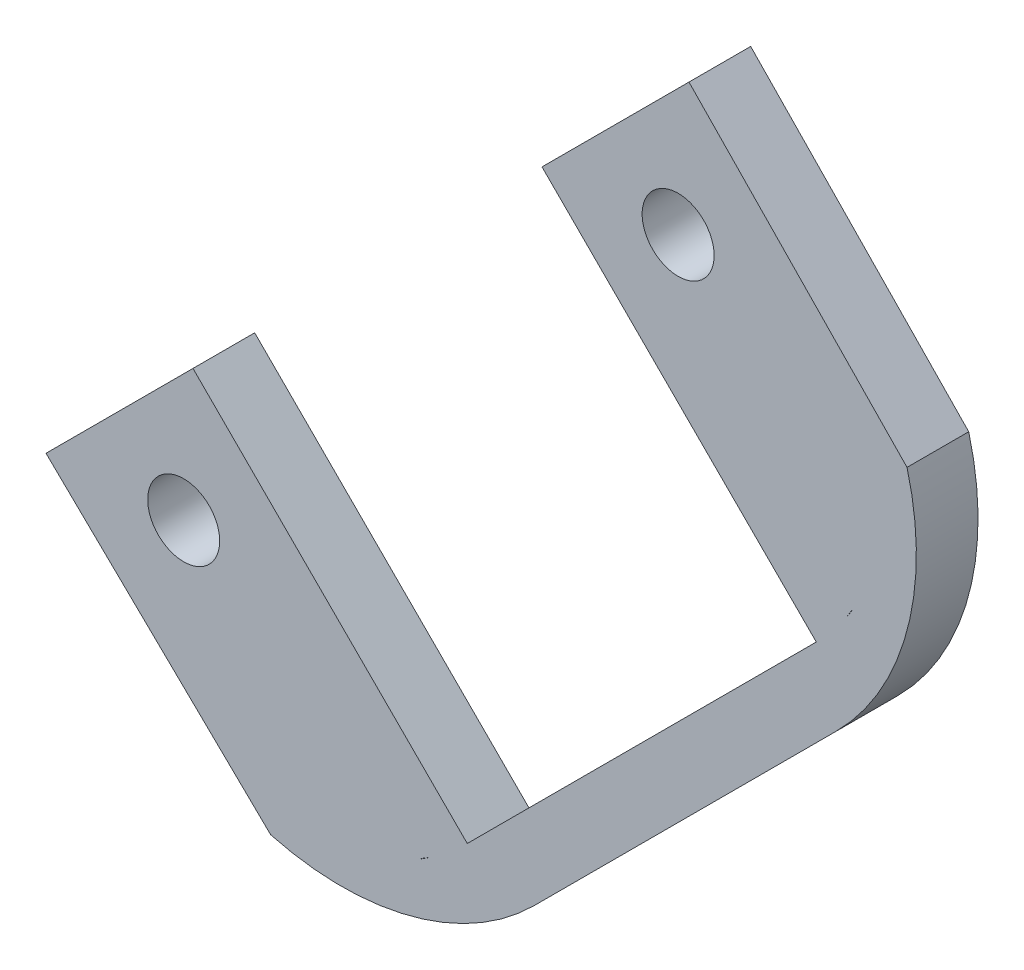
from build123d import *

# Parameters (mm, degrees)
SKETCH1_R           = 1.75
BOSS_EXTRUDE2_DEPTH = 3
CUT_EXTRUDE5_DEPTH  = 117.344085899


with BuildPart() as part:
    # Sketch1 → Boss-Extrude2 (new body)
    # profile 1 of 6: a face of its own
    with BuildSketch(Plane.XY):
        with BuildLine():
            Line((-61.518289963, 44.547727215), (-78.684996473, 61.714433725))
            ThreePointArc((-78.684996473, 61.714433725), (-82.079566173, 51.162002537), (-75.485462345, 42.251632055))
            ThreePointArc((-75.485462345, 42.251632055), (-69.588581896, 41.003233411), (-63.818207412, 42.745208303))
            ThreePointArc((-63.818207412, 42.745208303), (-63.605961831, 42.89146595), (-63.383207651, 43.021158129))
            ThreePointArc((-63.383207651, 43.021158129), (-62.41276888, 43.738044879), (-61.518289963, 44.547727215))
        make_face()
        with Locations((-75.306872196, 51.265241636)):
            Circle(SKETCH1_R, mode=Mode.SUBTRACT)
    # profile 2 of 6: a face of its own
    with BuildSketch(Plane.XY):
        with BuildLine():
            ThreePointArc((-63.818207412, 42.745208303), (-69.588581896, 41.003233411), (-75.485462345, 42.251632055))
            ThreePointArc((-75.485462345, 42.251632055), (-66.626510988, 39.720558383), (-58.255022397, 43.568354094))
            ThreePointArc((-58.255022397, 43.568354094), (-59.291136488, 43.01863263), (-60.457290906, 43.144370333))
            ThreePointArc((-60.457290906, 43.144370333), (-61.934255267, 43.415364041), (-63.383207651, 43.021158129))
            ThreePointArc((-63.383207651, 43.021158129), (-63.599243517, 42.880875383), (-63.818207412, 42.745208303))
        make_face()
    # profile 3 of 6: a face of its own
    with BuildSketch(Plane.XY):
        with BuildLine():
            Line((-53.033008589, 53.033008589), (-61.518289963, 44.547727215))
            ThreePointArc((-61.518289963, 44.547727215), (-62.41276888, 43.738044879), (-63.383207651, 43.021158129))
            ThreePointArc((-63.383207651, 43.021158129), (-61.934255267, 43.415364041), (-60.457290906, 43.144370333))
            ThreePointArc((-60.457290906, 43.144370333), (-59.291136488, 43.01863263), (-58.255022397, 43.568354094))
            Line((-58.255022397, 43.568354094), (-50.911688245, 50.911688245))
            Line((-50.911688245, 50.911688245), (-53.033008589, 53.033008589))
        make_face()
    # profile 4 of 6: a face of its own
    with BuildSketch(Plane.XY):
        with BuildLine():
            Line((-44.547727215, 61.518289963), (-53.033008589, 53.033008589))
            Line((-53.033008589, 53.033008589), (-50.911688245, 50.911688245))
            Line((-50.911688245, 50.911688245), (-43.568354094, 58.255022397))
            ThreePointArc((-43.568354094, 58.255022397), (-43.01863263, 59.291136488), (-43.144370333, 60.457290906))
            ThreePointArc((-43.144370333, 60.457290906), (-43.415364041, 61.934255267), (-43.021158129, 63.383207651))
            ThreePointArc((-43.021158129, 63.383207651), (-43.738044879, 62.41276888), (-44.547727215, 61.518289963))
        make_face()
    # profile 5 of 6: a face of its own
    with BuildSketch(Plane.XY):
        with BuildLine():
            ThreePointArc((-42.745208303, 63.818207412), (-42.880875383, 63.599243517), (-43.021158129, 63.383207651))
            ThreePointArc((-43.021158129, 63.383207651), (-43.415364041, 61.934255267), (-43.144370333, 60.457290906))
            ThreePointArc((-43.144370333, 60.457290906), (-43.01863263, 59.291136488), (-43.568354094, 58.255022397))
            ThreePointArc((-43.568354094, 58.255022397), (-39.720558383, 66.626510988), (-42.251632055, 75.485462345))
            ThreePointArc((-42.251632055, 75.485462345), (-41.003233411, 69.588581896), (-42.745208303, 63.818207412))
        make_face()
    # profile 6 of 6: a face of its own
    with BuildSketch(Plane.XY):
        with BuildLine():
            Line((-61.714433725, 78.684996473), (-44.547727215, 61.518289963))
            ThreePointArc((-44.547727215, 61.518289963), (-43.738044879, 62.41276888), (-43.021158129, 63.383207651))
            ThreePointArc((-43.021158129, 63.383207651), (-42.89146595, 63.605961831), (-42.745208303, 63.818207412))
            ThreePointArc((-42.745208303, 63.818207412), (-41.003233411, 69.588581896), (-42.251632055, 75.485462345))
            ThreePointArc((-42.251632055, 75.485462345), (-51.162002537, 82.079566173), (-61.714433725, 78.684996473))
        make_face()
        with Locations((-51.265241636, 75.306872196)):
            Circle(SKETCH1_R, mode=Mode.SUBTRACT)
    extrude(amount=BOSS_EXTRUDE2_DEPTH)

    # Sketch2 → Cut-Extrude5 (cut, through all)
    with BuildSketch(Plane.XY.offset(3)):
        with BuildLine():
            Line((-87.146030282, 55.882108481), (-82.002155393, 50.738233593))
            ThreePointArc((-82.002155393, 50.738233593), (-81.721300187, 56.642700912), (-78.684996473, 61.714433725))
            Line((-78.684996473, 61.714433725), (-74.855475867, 57.884913119))
            Line((-74.855475867, 57.884913119), (-73.595511338, 59.144877648))
            Line((-73.595511338, 59.144877648), (-82.002155393, 67.551521704))
            Line((-82.002155393, 67.551521704), (-87.146030282, 55.882108481))
        make_face()
        with BuildLine():
            ThreePointArc((-78.684996473, 61.714433725), (-81.721300187, 56.642700912), (-82.002155393, 50.738233593))
            Line((-82.002155393, 50.738233593), (-74.855475867, 57.884913119))
            Line((-74.855475867, 57.884913119), (-78.684996473, 61.714433725))
        make_face()
        with BuildLine():
            Line((-71.077925903, 40.135754876), (-82.002155393, 50.738233593))
            ThreePointArc((-82.002155393, 50.738233593), (-79.729344323, 45.738159691), (-75.485462345, 42.251632055))
            ThreePointArc((-75.485462345, 42.251632055), (-73.379988253, 40.988939163), (-71.077925903, 40.135754876))
        make_face()
        with BuildLine():
            ThreePointArc((-75.485462345, 42.251632055), (-79.729344323, 45.738159691), (-82.002155393, 50.738233593))
            Line((-82.002155393, 50.738233593), (-82.002155393, 40.135754876))
            Line((-82.002155393, 40.135754876), (-71.077925903, 40.135754876))
            ThreePointArc((-71.077925903, 40.135754876), (-73.379988253, 40.988939163), (-75.485462345, 42.251632055))
        make_face()
        with BuildLine():
            ThreePointArc((-61.714433725, 78.684996473), (-56.642700912, 81.721300187), (-50.738233593, 82.002155393))
            Line((-50.738233593, 82.002155393), (-55.882108481, 87.146030282))
            Line((-55.882108481, 87.146030282), (-67.551521704, 82.002155393))
            Line((-67.551521704, 82.002155393), (-59.144877648, 73.595511338))
            Line((-59.144877648, 73.595511338), (-57.884913119, 74.855475867))
            Line((-57.884913119, 74.855475867), (-61.714433725, 78.684996473))
        make_face()
        with BuildLine():
            Line((-57.884913119, 74.855475867), (-50.738233593, 82.002155393))
            ThreePointArc((-50.738233593, 82.002155393), (-56.642700912, 81.721300187), (-61.714433725, 78.684996473))
            Line((-61.714433725, 78.684996473), (-57.884913119, 74.855475867))
        make_face()
        with BuildLine():
            ThreePointArc((-42.251632055, 75.485462345), (-45.738159691, 79.729344323), (-50.738233593, 82.002155393))
            Line((-50.738233593, 82.002155393), (-40.135754876, 71.077925903))
            ThreePointArc((-40.135754876, 71.077925903), (-40.988939163, 73.379988253), (-42.251632055, 75.485462345))
        make_face()
        with BuildLine():
            Line((-40.135754876, 82.002155393), (-50.738233593, 82.002155393))
            ThreePointArc((-50.738233593, 82.002155393), (-45.738159691, 79.729344323), (-42.251632055, 75.485462345))
            ThreePointArc((-42.251632055, 75.485462345), (-40.988939163, 73.379988253), (-40.135754876, 71.077925903))
            Line((-40.135754876, 71.077925903), (-40.135754876, 82.002155393))
        make_face()
    extrude(amount=-CUT_EXTRUDE5_DEPTH, mode=Mode.SUBTRACT)


solid = part.part
